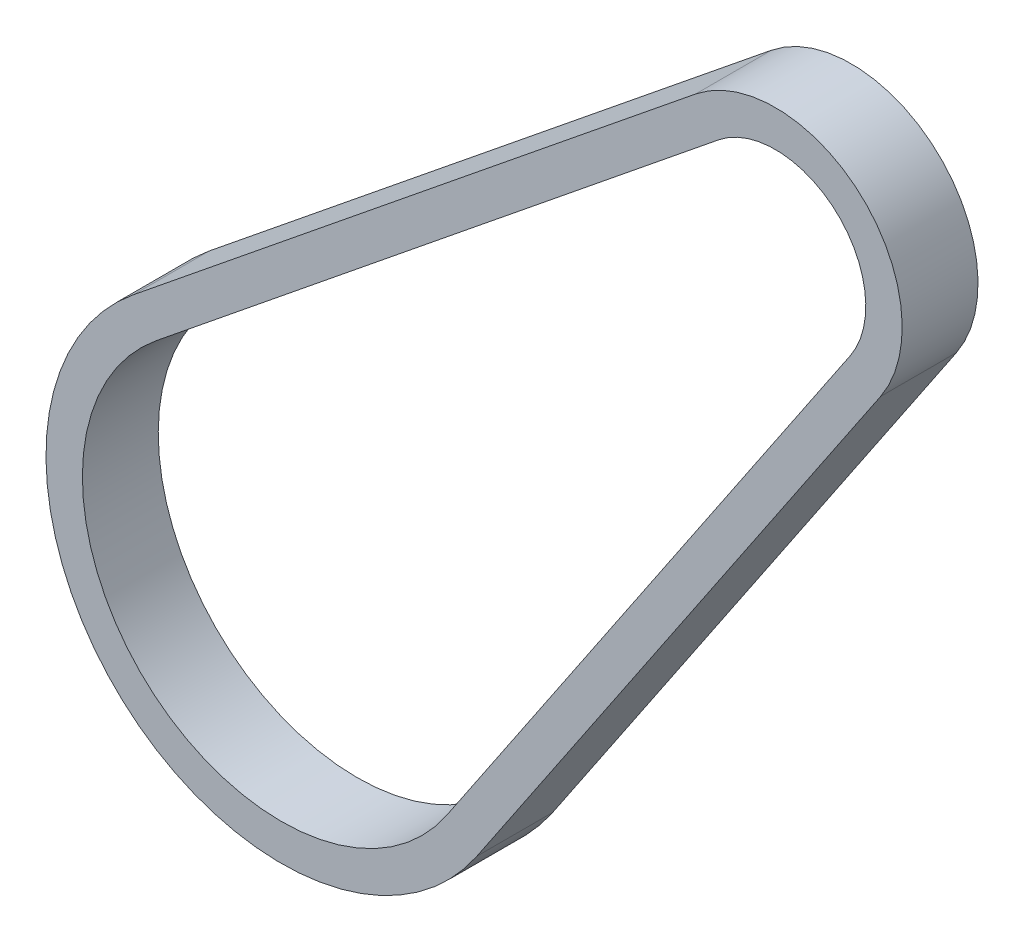
from build123d import *

# Parameters (mm, degrees)
EXTRUDE_THIN1_DEPTH = 5


with BuildPart() as part:
    # Sketch2 → Extrude-Thin1 (new body)
    with BuildSketch(Plane.XY):
        with BuildLine():
            Line((-9.765582909, 12.067570387), (27.300303168, 42.062836373))
            ThreePointArc((27.300303168, 42.062836373), (38.207290749, 41.73003182), (39.498257331, 30.894601868))
            Line((39.498257331, 30.894601868), (12.879835913, -8.666180902))
            ThreePointArc((12.879835913, -8.666180902), (-10.483165246, -11.449721001), (-9.765582909, 12.067570387))
        make_face()
        with BuildLine():
            Line((-8.255824972, 10.201925465), (28.810061104, 40.197191451))
            ThreePointArc((28.810061104, 40.197191451), (36.58659467, 39.959906338), (37.507036257, 32.234392387))
            Line((37.507036257, 32.234392387), (10.888614839, -7.326390383))
            ThreePointArc((10.888614839, -7.326390383), (-8.862469167, -9.67959552), (-8.255824972, 10.201925465))
        make_face(mode=Mode.SUBTRACT)
    extrude(amount=-EXTRUDE_THIN1_DEPTH)


solid = part.part
